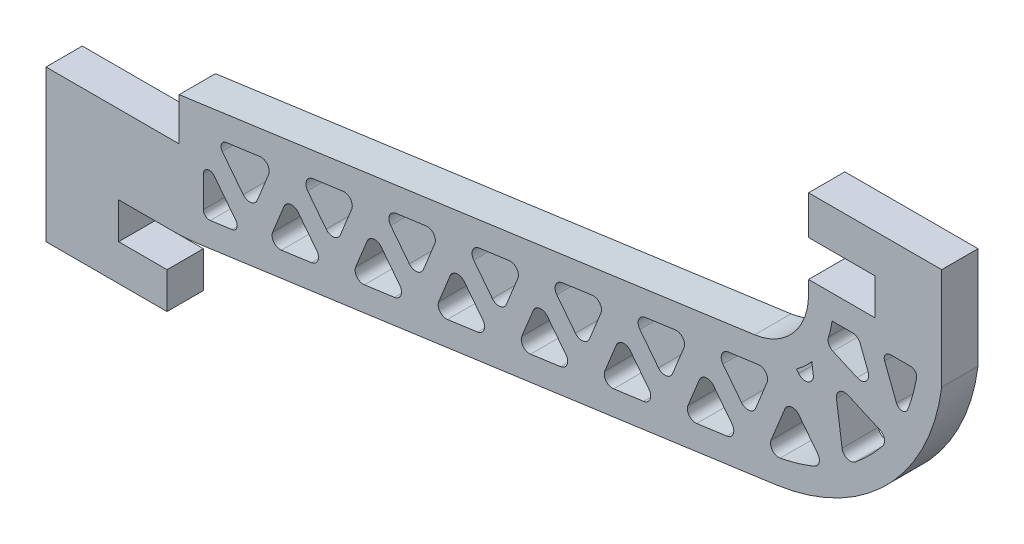
from build123d import *

# Parameters (mm, degrees)
BOSS_EXTRUDE1_DEPTH      = 1.5
BOSS_EXTRUDE1_DEPTH_BACK = 1.5
CUT_EXTRUDE1_DEPTH       = 97.892930599


with BuildPart() as part:
    # Sketch2 → Boss-Extrude1 (new, two sides: drawn at the far end of the back side and taken through both)
    with BuildSketch(Plane.XY.offset(-BOSS_EXTRUDE1_DEPTH_BACK)):
        with BuildLine():
            Line((21, 25.7), (10, 25.7))
            Line((10, 25.7), (10, 13.2))
            Line((10, 13.2), (20, 13.2))
            Line((20, 13.2), (20, 16.2))
            Line((20, 16.2), (16, 16.2))
            Line((16, 16.2), (16, 19.2))
            Line((16, 19.2), (20.413334427, 19.2))
            ThreePointArc((20.413334427, 19.2), (21.514093648, 19.237909625), (22.609636699, 19.351458858))
            Line((22.609636699, 19.351458858), (70.324123568, 25.963766893))
            ThreePointArc((70.324123568, 25.963766893), (79.504802191, 30.562227781), (84, 39.793906889))
            Line((84, 39.793906889), (84, 48.2))
            Line((84, 48.2), (73, 48.2))
            Line((73, 48.2), (73, 45))
            Line((73, 45), (78.5, 45))
            Line((78.5, 45), (78.5, 42))
            Line((78.5, 42), (73, 42))
            Line((73, 42), (73, 40.923009508))
            ThreePointArc((73, 40.923009508), (71.731436177, 37.53504676), (68.54967884, 35.813429496))
            Line((68.54967884, 35.813429496), (21, 29.223960678))
            Line((21, 29.223960678), (21, 25.7))
        make_face()
    extrude(amount=BOSS_EXTRUDE1_DEPTH + BOSS_EXTRUDE1_DEPTH_BACK)

    # Sketch3 → Cut-Extrude1 (cut, through all)
    with BuildSketch(Plane.XY.offset(1.5)):
        with BuildLine():
            ThreePointArc((68.845606373, 33.835358956), (68.834912629, 33.833852338), (68.824216624, 33.832361854))
            Line((68.824216624, 33.832361854), (66.366441576, 33.491761613))
            ThreePointArc((66.366441576, 33.491761613), (65.832234943, 33.07604522), (65.925152584, 32.405550507))
            Line((65.925152584, 32.405550507), (67.463514967, 30.428713892))
            ThreePointArc((67.463514967, 30.428713892), (68.090639241, 30.173935573), (68.624845874, 30.589651967))
            Line((68.624845874, 30.589651967), (69.567670912, 32.910369333))
            ThreePointArc((69.567670912, 32.910369333), (69.474125503, 33.581669489), (68.845606373, 33.835358956))
        make_face()
        with BuildLine():
            ThreePointArc((23.894596503, 24.866977158), (23.337670477, 25.032820088), (23, 24.559904529))
            Line((23, 24.559904529), (23, 21.998737656))
            ThreePointArc((23, 21.998737656), (23.171607874, 21.621698385), (23.568634446, 21.503470745))
            Line((23.568634446, 21.503470745), (25.367702767, 21.752786932))
            ThreePointArc((25.367702767, 21.752786932), (25.76229927, 22.059859561), (25.693664824, 22.555126472))
            Line((25.693664824, 22.555126472), (23.894596503, 24.866977158))
        make_face()
        with BuildLine():
            ThreePointArc((81.920929729, 39.414358962), (81.810954649, 39.821853601), (81.428318713, 40))
            Line((81.428318713, 40), (79.751268852, 40))
            ThreePointArc((79.751268852, 40), (79.338831369, 39.782657607), (79.284954484, 39.31958129))
            Line((79.284954484, 39.31958129), (80.263496972, 36.790417758))
            ThreePointArc((80.263496972, 36.790417758), (80.730403452, 36.470836818), (81.196551712, 36.791522705))
            ThreePointArc((81.196551712, 36.791522705), (81.622613406, 38.0853004), (81.920929729, 39.414358962))
        make_face()
        with BuildLine():
            Line((29.668414635, 25.563863631), (28.725605098, 23.24318442))
            ThreePointArc((28.725605098, 23.24318442), (28.818522739, 22.572689707), (29.445647013, 22.317911389))
            Line((29.445647013, 22.317911389), (31.926818933, 22.661753985))
            ThreePointArc((31.926818933, 22.661753985), (32.461025566, 23.077470379), (32.368107925, 23.747965091))
            Line((32.368107925, 23.747965091), (30.829745542, 25.724801707))
            ThreePointArc((30.829745542, 25.724801707), (30.202621268, 25.979580025), (29.668414635, 25.563863631))
        make_face()
        with BuildLine():
            Line((36.531034256, 26.514890412), (35.588224719, 24.194211201))
            ThreePointArc((35.588224719, 24.194211201), (35.68114236, 23.523716489), (36.308266634, 23.26893817))
            Line((36.308266634, 23.26893817), (38.789438554, 23.612780766))
            ThreePointArc((38.789438554, 23.612780766), (39.323645187, 24.02849716), (39.230727546, 24.698991872))
            Line((39.230727546, 24.698991872), (37.692365163, 26.675828488))
            ThreePointArc((37.692365163, 26.675828488), (37.065240889, 26.930606806), (36.531034256, 26.514890412))
        make_face()
        with BuildLine():
            Line((43.393653877, 27.465917193), (42.450844339, 25.145237982))
            ThreePointArc((42.450844339, 25.145237982), (42.543761981, 24.47474327), (43.170886255, 24.219964951))
            Line((43.170886255, 24.219964951), (45.652058175, 24.563807547))
            ThreePointArc((45.652058175, 24.563807547), (46.186264808, 24.979523941), (46.093347167, 25.650018653))
            Line((46.093347167, 25.650018653), (44.554984784, 27.626855269))
            ThreePointArc((44.554984784, 27.626855269), (43.92786051, 27.881633587), (43.393653877, 27.465917193))
        make_face()
        with BuildLine():
            Line((50.256273497, 28.416943974), (49.31346396, 26.096264763))
            ThreePointArc((49.31346396, 26.096264763), (49.406381602, 25.425770051), (50.033505876, 25.170991732))
            Line((50.033505876, 25.170991732), (52.514677796, 25.514834328))
            ThreePointArc((52.514677796, 25.514834328), (53.048884429, 25.930550722), (52.955966788, 26.601045434))
            Line((52.955966788, 26.601045434), (51.417604405, 28.57788205))
            ThreePointArc((51.417604405, 28.57788205), (50.790480131, 28.832660368), (50.256273497, 28.416943974))
        make_face()
        with BuildLine():
            Line((57.118893118, 29.367970755), (56.176083581, 27.047291544))
            ThreePointArc((56.176083581, 27.047291544), (56.269001223, 26.376796832), (56.896125497, 26.122018513))
            Line((56.896125497, 26.122018513), (59.377297417, 26.465861109))
            ThreePointArc((59.377297417, 26.465861109), (59.91150405, 26.881577503), (59.818586409, 27.552072215))
            Line((59.818586409, 27.552072215), (58.280224026, 29.528908831))
            ThreePointArc((58.280224026, 29.528908831), (57.653099752, 29.783687149), (57.118893118, 29.367970755))
        make_face()
        with BuildLine():
            Line((63.981512739, 30.318997536), (63.038703202, 27.998318325))
            ThreePointArc((63.038703202, 27.998318325), (63.131620844, 27.327823613), (63.758745118, 27.073045295))
            Line((63.758745118, 27.073045295), (66.239917038, 27.41688789))
            ThreePointArc((66.239917038, 27.41688789), (66.774123671, 27.832604284), (66.681206029, 28.503098996))
            Line((66.681206029, 28.503098996), (65.142843647, 30.479935612))
            ThreePointArc((65.142843647, 30.479935612), (64.515719372, 30.73471393), (63.981512739, 30.318997536))
        make_face()
        with BuildLine():
            Line((71.03910719, 31.749945253), (69.906900795, 28.963075009))
            ThreePointArc((69.906900795, 28.963075009), (70.009070674, 28.280956394), (70.656276301, 28.042525346))
            ThreePointArc((70.656276301, 28.042525346), (72.088726652, 28.384306368), (73.477349823, 28.874667425))
            ThreePointArc((73.477349823, 28.874667425), (73.873075154, 29.327031336), (73.752905838, 29.915920952))
            Line((73.752905838, 29.915920952), (72.200438098, 31.910883328))
            ThreePointArc((72.200438098, 31.910883328), (71.573313823, 32.165661646), (71.03910719, 31.749945253))
        make_face()
        with BuildLine():
            Line((78.87324466, 34.194450517), (76.251558944, 35.353396284))
            ThreePointArc((76.251558944, 35.353396284), (75.570309795, 35.274739521), (75.307380739, 34.641371065))
            Line((75.307380739, 34.641371065), (75.769433262, 31.307195021))
            ThreePointArc((75.769433262, 31.307195021), (76.189043969, 30.771420318), (76.862238539, 30.871103557))
            ThreePointArc((76.862238539, 30.871103557), (78.062870867, 31.94849589), (79.13159553, 33.156850069))
            ThreePointArc((79.13159553, 33.156850069), (79.256408934, 33.738890664), (78.87324466, 34.194450517))
        make_face()
        with BuildLine():
            ThreePointArc((24.887220396, 27.743541199), (24.492623892, 27.43646857), (24.561258338, 26.941201659))
            Line((24.561258338, 26.941201659), (26.287797241, 24.722553205))
            ThreePointArc((26.287797241, 24.722553205), (26.914921516, 24.467774887), (27.449128149, 24.883491281))
            Line((27.449128149, 24.883491281), (28.391937686, 27.204170492))
            ThreePointArc((28.391937686, 27.204170492), (28.299020045, 27.874665204), (27.67189577, 28.129443523))
            Line((27.67189577, 28.129443523), (24.887220396, 27.743541199))
        make_face()
        with BuildLine():
            ThreePointArc((32.053343472, 28.736627708), (31.519136838, 28.320911314), (31.61205448, 27.650416602))
            Line((31.61205448, 27.650416602), (33.150416862, 25.673579986))
            ThreePointArc((33.150416862, 25.673579986), (33.777541137, 25.418801668), (34.31174777, 25.834518062))
            Line((34.31174777, 25.834518062), (35.254557307, 28.155197273))
            ThreePointArc((35.254557307, 28.155197273), (35.161639666, 28.825691985), (34.534515391, 29.080470304))
            Line((34.534515391, 29.080470304), (32.053343472, 28.736627708))
        make_face()
        with BuildLine():
            ThreePointArc((38.915963093, 29.687654489), (38.381756459, 29.271938095), (38.474674101, 28.601443383))
            Line((38.474674101, 28.601443383), (40.013036483, 26.624606767))
            ThreePointArc((40.013036483, 26.624606767), (40.640160758, 26.369828449), (41.174367391, 26.785544843))
            Line((41.174367391, 26.785544843), (42.117176928, 29.106224054))
            ThreePointArc((42.117176928, 29.106224054), (42.024259287, 29.776718767), (41.397135012, 30.031497085))
            Line((41.397135012, 30.031497085), (38.915963093, 29.687654489))
        make_face()
        with BuildLine():
            ThreePointArc((45.778582713, 30.63868127), (45.24437608, 30.222964876), (45.337293722, 29.552470164))
            Line((45.337293722, 29.552470164), (46.875656104, 27.575633549))
            ThreePointArc((46.875656104, 27.575633549), (47.502780379, 27.32085523), (48.036987012, 27.736571624))
            Line((48.036987012, 27.736571624), (48.979796549, 30.057250836))
            ThreePointArc((48.979796549, 30.057250836), (48.886878907, 30.727745548), (48.259754633, 30.982523866))
            Line((48.259754633, 30.982523866), (45.778582713, 30.63868127))
        make_face()
        with BuildLine():
            ThreePointArc((52.641202334, 31.589708051), (52.106995701, 31.173991657), (52.199913342, 30.503496945))
            Line((52.199913342, 30.503496945), (53.738275725, 28.52666033))
            ThreePointArc((53.738275725, 28.52666033), (54.365399999, 28.271882011), (54.899606633, 28.687598405))
            Line((54.899606633, 28.687598405), (55.84241617, 31.008277617))
            ThreePointArc((55.84241617, 31.008277617), (55.749498528, 31.678772329), (55.122374254, 31.933550647))
            Line((55.122374254, 31.933550647), (52.641202334, 31.589708051))
        make_face()
        with BuildLine():
            ThreePointArc((59.503821955, 32.540734832), (58.969615322, 32.125018438), (59.062532963, 31.454523726))
            Line((59.062532963, 31.454523726), (60.600895346, 29.477687111))
            ThreePointArc((60.600895346, 29.477687111), (61.22801962, 29.222908792), (61.762226254, 29.638625186))
            Line((61.762226254, 29.638625186), (62.705035791, 31.959304398))
            ThreePointArc((62.705035791, 31.959304398), (62.612118149, 32.62979911), (61.984993875, 32.884577428))
            Line((61.984993875, 32.884577428), (59.503821955, 32.540734832))
        make_face()
        with BuildLine():
            ThreePointArc((73.266844849, 36.252951147), (72.668886462, 35.637175167), (72.001524521, 35.097395276))
            Line((72.001524521, 35.097395276), (72.184352367, 34.862456628))
            ThreePointArc((72.184352367, 34.862456628), (72.98184735, 34.654573718), (73.389053712, 35.371090663))
            Line((73.389053712, 35.371090663), (73.266844849, 36.252951147))
        make_face()
        with BuildLine():
            ThreePointArc((74.645299158, 38.697616119), (74.670374657, 38.21164795), (75.01497739, 37.86807438))
            Line((75.01497739, 37.86807438), (77.020518238, 36.981502408))
            ThreePointArc((77.020518238, 36.981502408), (77.761448412, 37.110837194), (77.925500352, 37.844861697))
            Line((77.925500352, 37.844861697), (77.259063681, 39.567349321))
            ThreePointArc((77.259063681, 39.567349321), (77.01042828, 39.881457446), (76.62776506, 40))
            Line((76.62776506, 40), (74.940243903, 40))
            ThreePointArc((74.940243903, 40), (74.823206975, 39.341915488), (74.645299158, 38.697616119))
        make_face()
    extrude(amount=-CUT_EXTRUDE1_DEPTH, mode=Mode.SUBTRACT)


solid = part.part
